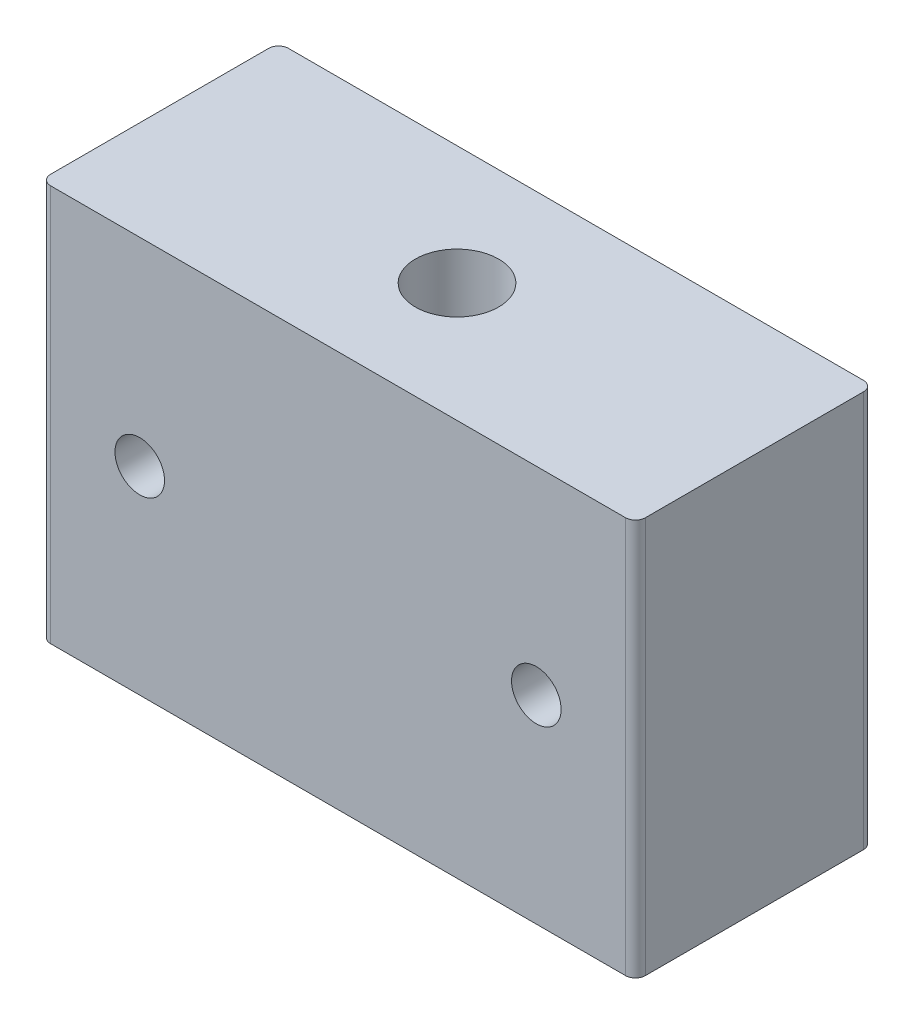
from build123d import *

# Parameters (mm, degrees)
SKETCH1_W                   = 30
SKETCH1_H                   = 12
BOSS_EXTRUDE1_DEPTH         = 20
TAP_DRILL_FOR_M5X0_8_TAP1_D = 4.2
TAP_DRILL_FOR_M3X0_5_TAP1_D = 2.5
FILLET1_R                   = 0.5


with BuildPart() as part:
    # Sketch1 → Boss-Extrude1 (new body)
    with BuildSketch(Plane(origin=(0, 0, 0), x_dir=(1, 0, 0), z_dir=(0, 1, 0))):
        Rectangle(SKETCH1_W, SKETCH1_H)
    extrude(amount=BOSS_EXTRUDE1_DEPTH)

    # Tap Drill for M5x0.8 Tap1 (through all)
    with Locations(Plane(origin=(0, 0, 0), x_dir=(-1, 0, 0), z_dir=(0, -1, 0))):
        with Locations((0, 0)):
            Hole(TAP_DRILL_FOR_M5X0_8_TAP1_D / 2)

    # Tap Drill for M3x0.5 Tap1 (through all)
    with Locations(Plane.XY.offset(6)):
        with Locations((-10, 10), (10, 10)):
            Hole(TAP_DRILL_FOR_M3X0_5_TAP1_D / 2)

    # Fillet1
    fillet1_edges = [part.edges().sort_by_distance(p)[0] for p in [
        (-15, 10, -6),
        (15, 10, -6),
        (15, 10, 6),
        (-15, 10, 6),
    ]]
    fillet(fillet1_edges, radius=FILLET1_R)


solid = part.part
